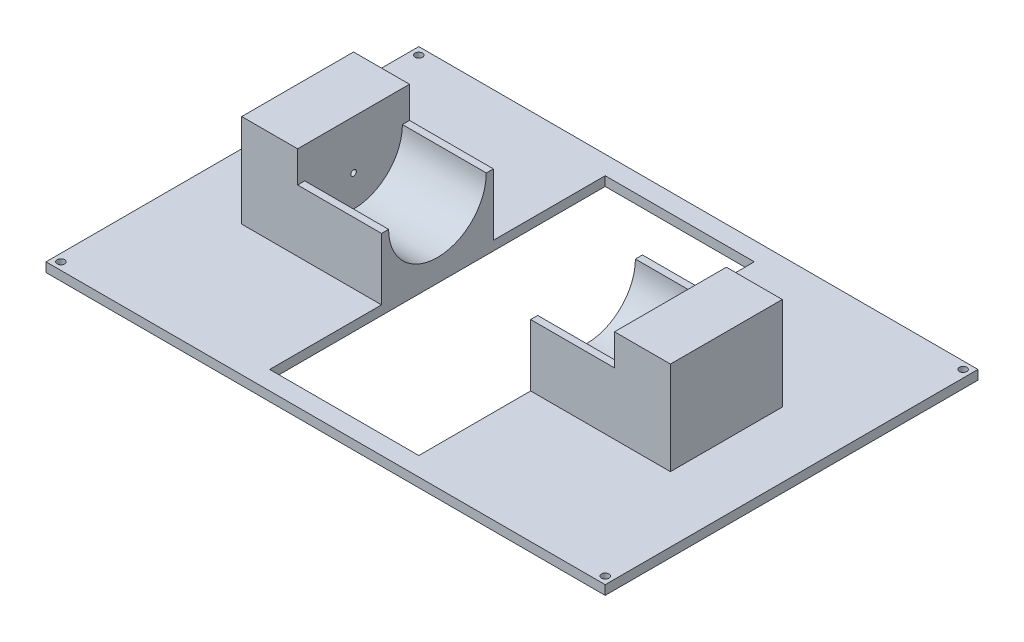
from build123d import *

# Parameters (mm, degrees)
SKETCH1_W           = 300
SKETCH1_H           = 200
SKETCH1_R           = 2
BOSS_EXTRUDE1_DEPTH = 5
CUT_EXTRUDE1_REACH  = 182.347
SKETCH3_W           = 80
SKETCH3_H           = 180
SKETCH4_W           = 30
SKETCH4_H           = 60
BOSS_EXTRUDE2_DEPTH = 50
BOSS_EXTRUDE3_DEPTH = 45
SKETCH7_R           = 1.5
CUT_EXTRUDE2_DEPTH  = 5


with BuildPart() as part:
    # Sketch1 → Boss-Extrude1 (new body)
    with BuildSketch(Plane(origin=(0, 0, 0), x_dir=(1, 0, 0), z_dir=(0, 1, 0))):
        Rectangle(SKETCH1_W, SKETCH1_H)
        with Locations(Location((-146, 96, 0), (0, 0, 270))):
            Circle(SKETCH1_R, mode=Mode.SUBTRACT)
        with Locations(Location((146, 96, 0), (0, 0, 90))):
            Circle(SKETCH1_R, mode=Mode.SUBTRACT)
        with Locations(Location((146, -96, 0), (0, 0, 270))):
            Circle(SKETCH1_R, mode=Mode.SUBTRACT)
        with Locations(Location((-146, -96, 0), (0, 0, 90))):
            Circle(SKETCH1_R, mode=Mode.SUBTRACT)
    extrude(amount=BOSS_EXTRUDE1_DEPTH)

    # Sketch3 → Cut-Extrude1 (cut, up to next)
    with BuildSketch(Plane(origin=(0, 5, 0), x_dir=(1, 0, 0), z_dir=(0, 1, 0)), mode=Mode.PRIVATE) as cut_extrude1_sk1:
        Rectangle(SKETCH3_W, SKETCH3_H)
    cut_extrude1_tool1 = extrude(cut_extrude1_sk1.sketch, amount=-CUT_EXTRUDE1_REACH, mode=Mode.PRIVATE) & part.part
    add(cut_extrude1_tool1.solids().sort_by_distance((0, 5, 0))[0], mode=Mode.SUBTRACT)

    # Sketch4 → Boss-Extrude2 (add)
    with BuildSketch(Plane(origin=(0, 5, 0), x_dir=(1, 0, 0), z_dir=(0, 1, 0))):
        with Locations((-100, 0)):
            Rectangle(SKETCH4_W, SKETCH4_H)
    boss_extrude2 = extrude(amount=BOSS_EXTRUDE2_DEPTH)

    # Sketch5 → Boss-Extrude3 (add)
    with BuildSketch(Plane(origin=(-85, 0, 0), x_dir=(0, 0, -1), z_dir=(1, 0, 0))):
        with BuildLine():
            Line((-26.2, 38.191891423), (-30, 38.191891423))
            Line((-30, 38.191891423), (-30, 5))
            Line((-30, 5), (30, 5))
            Line((30, 5), (30, 38.191891423))
            Line((30, 38.191891423), (26.2, 38.191891423))
            ThreePointArc((26.2, 38.191891423), (0, 11.991891423), (-26.2, 38.191891423))
        make_face()
    boss_extrude3 = extrude(amount=BOSS_EXTRUDE3_DEPTH)

    # Sketch7 → Cut-Extrude2 (cut)
    with BuildSketch(Plane(origin=(-85, 0, 0), x_dir=(0, 0, -1), z_dir=(1, 0, 0))):
        with Locations((0, 28.765136386)):
            Circle(SKETCH7_R)
    cut_extrude2 = extrude(amount=-CUT_EXTRUDE2_DEPTH, mode=Mode.SUBTRACT)

    # Mirror3: Boss-Extrude2, Boss-Extrude3, Cut-Extrude2 across plane
    add(boss_extrude2.mirror(Plane(origin=(0, 0, 0), x_dir=(0, 0, 1), z_dir=(1, 0, 0))))
    add(boss_extrude3.mirror(Plane(origin=(0, 0, 0), x_dir=(0, 0, 1), z_dir=(1, 0, 0))))
    add(cut_extrude2.mirror(Plane(origin=(0, 0, 0), x_dir=(0, 0, 1), z_dir=(1, 0, 0))), mode=Mode.SUBTRACT)


solid = part.part
